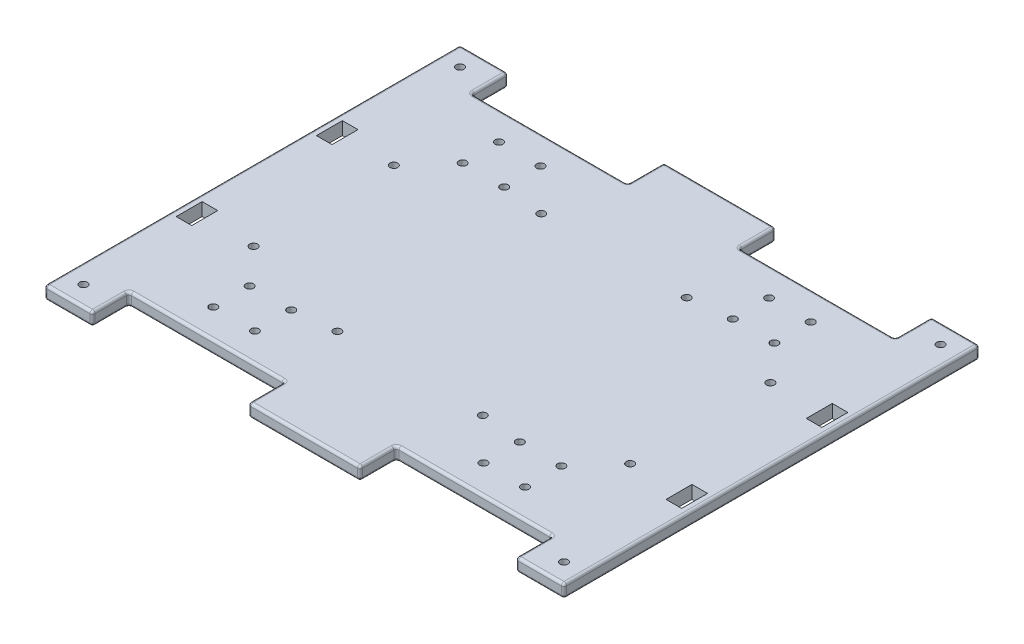
from build123d import *

# Parameters (mm, degrees)
SKETCH2_W                = 200
SKETCH2_H                = 160
BOSS_EXTRUDE1_DEPTH      = 5
SKETCH3_R                = 1.5
CUT_EXTRUDE1_DEPTH       = 129.16005618
MIRROR2_COPY_1_SKETCH_R  = 1.5
MIRROR2_COPY_1_DEPTH     = 129.16005618
SKETCH4_R                = 1.5
CUT_EXTRUDE2_DEPTH       = 129.16005618
MIRROR4_COPY_1_SKETCH_R  = 1.5
MIRROR4_COPY_1_DEPTH     = 129.16005618
CUT_EXTRUDE4_DEPTH       = 129.16005618
MIRROR9_COPY_1_DEPTH     = 129.16005618
SKETCH9_R                = 1.5
CUT_EXTRUDE5_DEPTH       = 129.16005618
MIRROR11_COPY_1_SKETCH_R = 1.5
MIRROR11_COPY_1_DEPTH    = 129.16005618
SKETCH10_R               = 1.5
SKETCH10_W               = 6
SKETCH10_H               = 10
CUT_EXTRUDE6_DEPTH       = 129.16005618
MIRROR13_COPY_1_SKETCH_R = 1.5
MIRROR13_COPY_1_SKETCH_W = 6
MIRROR13_COPY_1_SKETCH_H = 10
MIRROR13_COPY_1_DEPTH    = 129.16005618
FILLET3_R                = 1


with BuildPart() as part:
    # Sketch2 → Boss-Extrude1 (new body)
    with BuildSketch(Plane(origin=(0, 0, 0), x_dir=(1, 0, 0), z_dir=(0, 1, 0))):
        Rectangle(SKETCH2_W, SKETCH2_H)
    extrude(amount=BOSS_EXTRUDE1_DEPTH)

    # Sketch3 → Cut-Extrude1 (cut, through all)
    with BuildSketch(Plane(origin=(0, 5, 0), x_dir=(1, 0, 0), z_dir=(0, 1, 0))):
        with Locations(Location((92.5, 72.5, 0), (0, 0, 270))):
            Circle(SKETCH3_R)
    cut_extrude1 = extrude(amount=-CUT_EXTRUDE1_DEPTH, mode=Mode.SUBTRACT)

    # Mirror1: Cut-Extrude1 across plane
    add(cut_extrude1.mirror(Plane(origin=(0, 0, 0), x_dir=(0, 0, 1), z_dir=(1, 0, 0))), mode=Mode.SUBTRACT)

    # Mirror2: Cut-Extrude1 across plane
    add(cut_extrude1.mirror(Plane.XY), mode=Mode.SUBTRACT)

    # Mirror2 copy 1 sketch → Mirror2 copy 1 (cut, through all)
    with BuildSketch(Plane(origin=(0, 5, 0), x_dir=(-1, 0, 0), z_dir=(0, 1, 0))):
        with Locations(Location((92.5, 72.5, 0), (0, 0, 270))):
            Circle(MIRROR2_COPY_1_SKETCH_R)
    extrude(amount=-MIRROR2_COPY_1_DEPTH, mode=Mode.SUBTRACT)

    # Sketch4 → Cut-Extrude2 (cut, through all)
    with BuildSketch(Plane(origin=(0, 5, 0), x_dir=(1, 0, 0), z_dir=(0, 1, 0))):
        with Locations(Location((-60, -55, 0), (0, 0, 270))):
            Circle(SKETCH4_R)
        with Locations(Location((-60, -41, 0), (0, 0, 90))):
            Circle(SKETCH4_R)
        with Locations(Location((-44, -55, 0), (0, 0, 90))):
            Circle(SKETCH4_R)
        with Locations(Location((-44, -41, 0), (0, 0, 270))):
            Circle(SKETCH4_R)
    cut_extrude2 = extrude(amount=-CUT_EXTRUDE2_DEPTH, mode=Mode.SUBTRACT)

    # Mirror3: Cut-Extrude2 across plane
    add(cut_extrude2.mirror(Plane(origin=(0, 0, 0), x_dir=(0, 0, 1), z_dir=(1, 0, 0))), mode=Mode.SUBTRACT)

    # Mirror4: Cut-Extrude2 across plane
    add(cut_extrude2.mirror(Plane.XY), mode=Mode.SUBTRACT)

    # Mirror4 copy 1 sketch → Mirror4 copy 1 (cut, through all)
    with BuildSketch(Plane(origin=(0, 5, 0), x_dir=(-1, 0, 0), z_dir=(0, 1, 0))):
        with Locations(Location((-60, -55, 0), (0, 0, 270))):
            Circle(MIRROR4_COPY_1_SKETCH_R)
        with Locations(Location((-60, -41, 0), (0, 0, 90))):
            Circle(MIRROR4_COPY_1_SKETCH_R)
        with Locations(Location((-44, -55, 0), (0, 0, 90))):
            Circle(MIRROR4_COPY_1_SKETCH_R)
        with Locations(Location((-44, -41, 0), (0, 0, 270))):
            Circle(MIRROR4_COPY_1_SKETCH_R)
    extrude(amount=-MIRROR4_COPY_1_DEPTH, mode=Mode.SUBTRACT)

    # Sketch6 → Cut-Extrude4 (cut, symmetric)
    with BuildSketch(Plane(origin=(0, 5, 0), x_dir=(1, 0, 0), z_dir=(0, 1, 0))):
        Polygon((-21.5, -573.910115621), (-21.5, -80), (-21.5, -66), (-81.5, -66), (-81.5, -80), (-81.5, -573.910115621), (-81.5, -1561.730346862), (-21.5, -1561.730346862), align=None)
    cut_extrude4 = extrude(amount=CUT_EXTRUDE4_DEPTH, both=True, mode=Mode.SUBTRACT)

    # Mirror8: Cut-Extrude4 across plane
    add(cut_extrude4.mirror(Plane.XY), mode=Mode.SUBTRACT)

    # Mirror9: Cut-Extrude4 across plane
    add(cut_extrude4.mirror(Plane(origin=(0, 0, 0), x_dir=(0, 0, 1), z_dir=(1, 0, 0))), mode=Mode.SUBTRACT)

    # Mirror9 copy 1 sketch → Mirror9 copy 1 (cut, symmetric)
    with BuildSketch(Plane(origin=(0, 5, 0), x_dir=(-1, 0, 0), z_dir=(0, 1, 0))):
        Polygon((-21.5, -573.910115621), (-21.5, -80), (-21.5, -66), (-81.5, -66), (-81.5, -80), (-81.5, -573.910115621), (-81.5, -1561.730346862), (-21.5, -1561.730346862), align=None)
    extrude(amount=MIRROR9_COPY_1_DEPTH, both=True, mode=Mode.SUBTRACT)

    # Sketch9 → Cut-Extrude5 (cut, through all)
    with BuildSketch(Plane(origin=(0, 0, 0), x_dir=(-1, 0, 0), z_dir=(0, -1, 0))):
        with Locations(Location((28, -39.25, 0), (0, 0, 90))):
            Circle(SKETCH9_R)
    cut_extrude5 = extrude(amount=-CUT_EXTRUDE5_DEPTH, mode=Mode.SUBTRACT)

    # Mirror10: Cut-Extrude5 across plane
    add(cut_extrude5.mirror(Plane.XY), mode=Mode.SUBTRACT)

    # Mirror11: Cut-Extrude5 across plane
    add(cut_extrude5.mirror(Plane(origin=(0, 0, 0), x_dir=(0, 0, 1), z_dir=(1, 0, 0))), mode=Mode.SUBTRACT)

    # Mirror11 copy 1 sketch → Mirror11 copy 1 (cut, through all)
    with BuildSketch(Plane.XZ):
        with Locations(Location((28, -39.25, 0), (0, 0, 90))):
            Circle(MIRROR11_COPY_1_SKETCH_R)
    extrude(amount=-MIRROR11_COPY_1_DEPTH, mode=Mode.SUBTRACT)

    # Sketch10 → Cut-Extrude6 (cut, through all)
    with BuildSketch(Plane(origin=(0, 5, 0), x_dir=(1, 0, 0), z_dir=(0, 1, 0))):
        with Locations(Location((-72.5, -27, 0), (0, 0, 270))):
            Circle(SKETCH10_R)
        with Locations((-94.3, -27)):
            Rectangle(SKETCH10_W, SKETCH10_H)
    cut_extrude6 = extrude(amount=-CUT_EXTRUDE6_DEPTH, mode=Mode.SUBTRACT)

    # Mirror12: Cut-Extrude6 across plane
    add(cut_extrude6.mirror(Plane.XY), mode=Mode.SUBTRACT)

    # Mirror13: Cut-Extrude6 across plane
    add(cut_extrude6.mirror(Plane(origin=(0, 0, 0), x_dir=(0, 0, 1), z_dir=(1, 0, 0))), mode=Mode.SUBTRACT)

    # Mirror13 copy 1 sketch → Mirror13 copy 1 (cut, through all)
    with BuildSketch(Plane(origin=(0, 5, 0), x_dir=(-1, 0, 0), z_dir=(0, 1, 0))):
        with Locations(Location((-72.5, -27, 0), (0, 0, 270))):
            Circle(MIRROR13_COPY_1_SKETCH_R)
        with Locations((-94.3, -27)):
            Rectangle(MIRROR13_COPY_1_SKETCH_W, MIRROR13_COPY_1_SKETCH_H)
    extrude(amount=-MIRROR13_COPY_1_DEPTH, mode=Mode.SUBTRACT)

    # Fillet3
    fillet3_edges = [part.edges().sort_by_distance(p)[0] for p in [
        (0, 0, 80),
        (-81.5, 0, 73),
        (-51.5, 0, 66),
        (-21.5, 0, 73),
        (0, 5, 80),
        (-21.5, 2.5, 66),
        (-81.5, 2.5, 66),
        (-81.5, 2.5, 80),
        (-21.5, 2.5, 80),
        (-21.5, 5, 73),
        (-51.5, 5, 66),
        (-81.5, 5, 73),
        (-90.75, 0, -80),
        (-81.5, 0, -73),
        (-51.5, 0, -66),
        (-21.5, 0, -73),
        (-90.75, 5, -80),
        (-21.5, 5, -73),
        (-21.5, 2.5, -80),
        (-51.5, 5, -66),
        (-21.5, 2.5, -66),
        (-81.5, 5, -73),
        (-81.5, 2.5, -66),
        (-81.5, 2.5, -80),
        (-100, 5, 0),
        (0, 0, -80),
        (81.5, 0, -73),
        (51.5, 0, -66),
        (21.5, 0, -73),
        (0, 5, -80),
        (21.5, 2.5, -66),
        (81.5, 2.5, -66),
        (81.5, 2.5, -80),
        (21.5, 2.5, -80),
        (21.5, 5, -73),
        (51.5, 5, -66),
        (81.5, 5, -73),
        (90.75, 5, 80),
        (90.75, 0, 80),
        (81.5, 2.5, 80),
        (21.5, 2.5, 80),
        (51.5, 0, 66),
        (51.5, 5, 66),
        (21.5, 2.5, 66),
        (21.5, 5, 73),
        (21.5, 0, 73),
        (81.5, 5, 73),
        (81.5, 2.5, 66),
        (81.5, 0, 73),
        (-90.75, 5, 80),
        (100, 5, 0),
        (-90.75, 0, 80),
        (-100, 0, 0),
        (90.75, 0, -80),
        (100, 0, 0),
        (100, 2.5, 80),
        (-100, 2.5, 80),
        (-100, 2.5, -80),
        (100, 2.5, -80),
        (90.75, 5, -80),
    ]]
    fillet(fillet3_edges, radius=FILLET3_R)


solid = part.part
